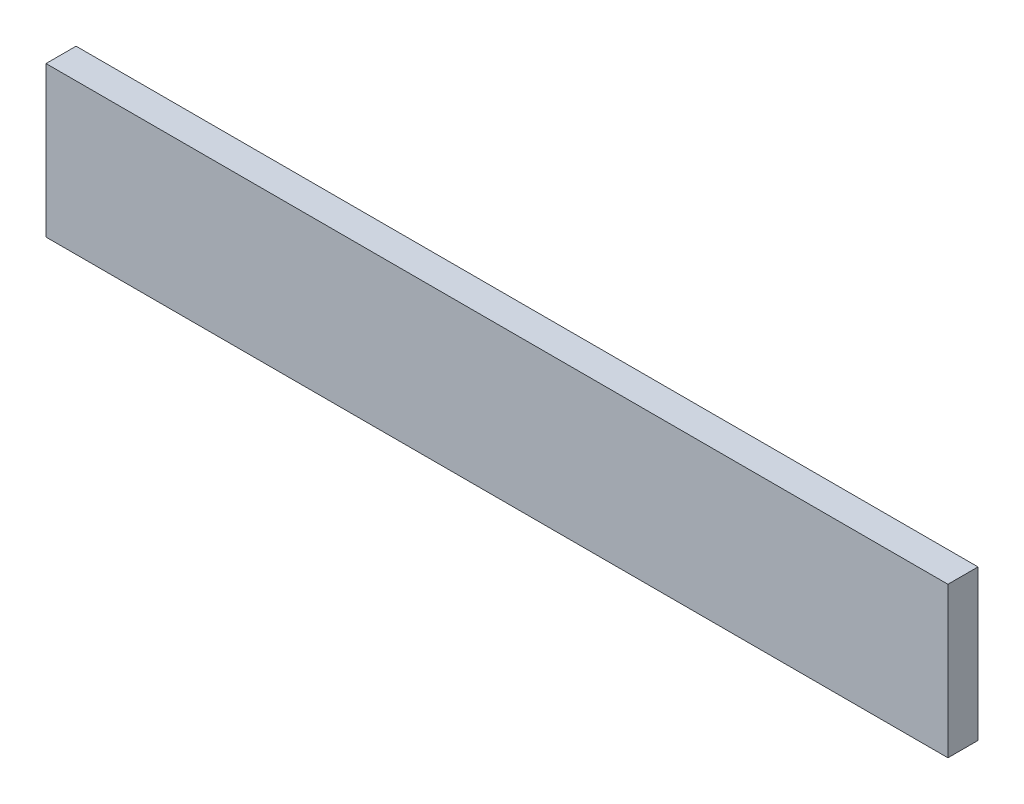
from build123d import *

# Parameters (mm, degrees)
SKETCH1_W   = 600
SKETCH1_H   = 100
THICKEN1_T1 = 20


with BuildPart() as body_1:
    # Sketch1 → Surface-Plane1: a flat surface bounded by the sketch
    with BuildSketch(Plane.XY, mode=Mode.PRIVATE) as surface_plane1_1_region:
        with Locations((300, -50)):
            Rectangle(SKETCH1_W, SKETCH1_H)
    surface_plane1_1 = surface_plane1_1_region.sketch.faces()[0]
    add(Solid.thicken(surface_plane1_1, THICKEN1_T1))


solid = body_1.part
